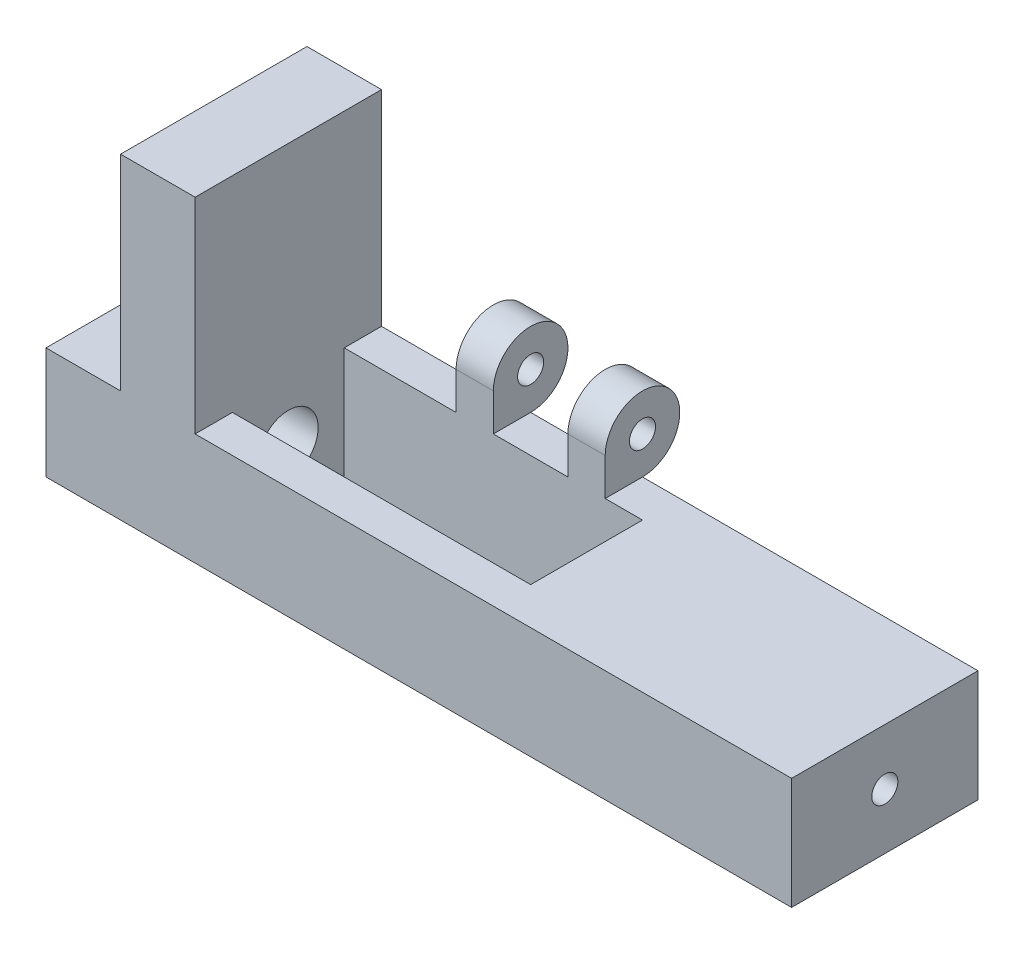
from build123d import *

# Parameters (mm, degrees)
SKETCH2_W                            = 100
SKETCH2_H                            = 25
SKETCH2_W_2                          = 40
SKETCH2_H_2                          = 15
BOSS_EXTRUDE1_DEPTH                  = 15
CUT_EXTRUDE1_REACH                   = 103.888
SKETCH3_R                            = 1.75
CUT_EXTRUDE2_REACH                   = 103.888
SKETCH4_R                            = 4
F_3_2_3_2_DIAMETER_HOLE1_D           = 3.2
F_3_2_3_2_DIAMETER_HOLE1_CSINK_D     = 3.25
F_3_2_3_2_DIAMETER_HOLE1_CSINK_ANGLE = 90
SKETCH8_W                            = 10
SKETCH8_H                            = 25
BOSS_EXTRUDE2_DEPTH                  = 27.5
SKETCH9_R                            = 1.75
BOSS_EXTRUDE3_DEPTH                  = 40
CUT_EXTRUDE3_REACH                   = 70.283
SKETCH10_W                           = 15
SKETCH10_H                           = 10
SKETCH10_W_2                         = 10
SKETCH10_W_3                         = 5


with BuildPart() as part:
    # Sketch2 → Boss-Extrude1 (new body)
    with BuildSketch(Plane(origin=(0, 0, 0), x_dir=(1, 0, 0), z_dir=(0, 1, 0))):
        with Locations((10, 0)):
            Rectangle(SKETCH2_W, SKETCH2_H)
        Rectangle(SKETCH2_W_2, SKETCH2_H_2, mode=Mode.SUBTRACT)
    extrude(amount=BOSS_EXTRUDE1_DEPTH)

    # Sketch3 → Cut-Extrude1 (cut, up to next)
    with BuildSketch(Plane(origin=(60, 0, 0), x_dir=(0, 0, -1), z_dir=(1, 0, 0)), mode=Mode.PRIVATE) as cut_extrude1_sk1:
        with Locations((0, 7.5)):
            Circle(SKETCH3_R)
    cut_extrude1_tool1 = extrude(cut_extrude1_sk1.sketch, amount=-CUT_EXTRUDE1_REACH, mode=Mode.PRIVATE) & part.part
    add(cut_extrude1_tool1.solids().sort_by_distance((60, 7.5, 0))[0], mode=Mode.SUBTRACT)

    # Sketch4 → Cut-Extrude2 (cut, up to next)
    with BuildSketch(Plane.ZY.offset(40), mode=Mode.PRIVATE) as cut_extrude2_sk1:
        with Locations((0, 7.5)):
            Circle(SKETCH4_R)
    cut_extrude2_tool1 = extrude(cut_extrude2_sk1.sketch, amount=-CUT_EXTRUDE2_REACH, mode=Mode.PRIVATE) & part.part
    add(cut_extrude2_tool1.solids().sort_by_distance((-40, 7.5, 0))[0], mode=Mode.SUBTRACT)

    # Ø3.2 (3.2) Diameter Hole1 (through all)
    with Locations(Plane(origin=(0, 15, 0), x_dir=(1, 0, 0), z_dir=(0, 1, 0))):
        with Locations((-35, 0)):
            CounterSinkHole(F_3_2_3_2_DIAMETER_HOLE1_D / 2, F_3_2_3_2_DIAMETER_HOLE1_CSINK_D / 2, counter_sink_angle=F_3_2_3_2_DIAMETER_HOLE1_CSINK_ANGLE)

    # Sketch8 → Boss-Extrude2 (add)
    with BuildSketch(Plane(origin=(0, 15, 0), x_dir=(1, 0, 0), z_dir=(0, 1, 0))):
        with Locations((-25, 0)):
            Rectangle(SKETCH8_W, SKETCH8_H)
    extrude(amount=BOSS_EXTRUDE2_DEPTH)

    # Sketch9 → Boss-Extrude3 (add)
    with BuildSketch(Plane(origin=(-20, 0, 0), x_dir=(0, 0, -1), z_dir=(1, 0, 0))):
        with BuildLine():
            Line((7.5, 20), (7.5, 15))
            Line((7.5, 15), (12.5, 15))
            ThreePointArc((12.5, 15), (16.035533906, 23.535533906), (7.5, 20))
        make_face()
        with Locations(Location((12.5, 20, 0), (0, 0, 90))):
            Circle(SKETCH9_R, mode=Mode.SUBTRACT)
    extrude(amount=BOSS_EXTRUDE3_DEPTH)

    # Sketch10 → Cut-Extrude3 (cut, up to next)
    with BuildSketch(Plane(origin=(0, 15, 0), x_dir=(1, 0, 0), z_dir=(0, 1, 0)), mode=Mode.PRIVATE) as cut_extrude3_sk1:
        with Locations((-12.5, 12.5)):
            Rectangle(SKETCH10_W, SKETCH10_H)
    cut_extrude3_tool1 = extrude(cut_extrude3_sk1.sketch, amount=CUT_EXTRUDE3_REACH, mode=Mode.PRIVATE) & part.part
    # Sketch10 → Cut-Extrude3 (cut, up to next)
    with BuildSketch(Plane(origin=(0, 15, 0), x_dir=(1, 0, 0), z_dir=(0, 1, 0)), mode=Mode.PRIVATE) as cut_extrude3_sk2:
        with Locations((5, 12.5)):
            Rectangle(SKETCH10_W_2, SKETCH10_H)
    cut_extrude3_tool2 = extrude(cut_extrude3_sk2.sketch, amount=CUT_EXTRUDE3_REACH, mode=Mode.PRIVATE) & part.part
    # Sketch10 → Cut-Extrude3 (cut, up to next)
    with BuildSketch(Plane(origin=(0, 15, 0), x_dir=(1, 0, 0), z_dir=(0, 1, 0)), mode=Mode.PRIVATE) as cut_extrude3_sk3:
        with Locations((17.5, 12.5)):
            Rectangle(SKETCH10_W_3, SKETCH10_H)
    cut_extrude3_tool3 = extrude(cut_extrude3_sk3.sketch, amount=CUT_EXTRUDE3_REACH, mode=Mode.PRIVATE) & part.part
    add(cut_extrude3_tool1.solids().sort_by_distance((-12.5, 15, -12.5))[0], mode=Mode.SUBTRACT)
    add(cut_extrude3_tool2.solids().sort_by_distance((5, 15, -12.5))[0], mode=Mode.SUBTRACT)
    add(cut_extrude3_tool3.solids().sort_by_distance((17.5, 15, -12.5))[0], mode=Mode.SUBTRACT)


solid = part.part
